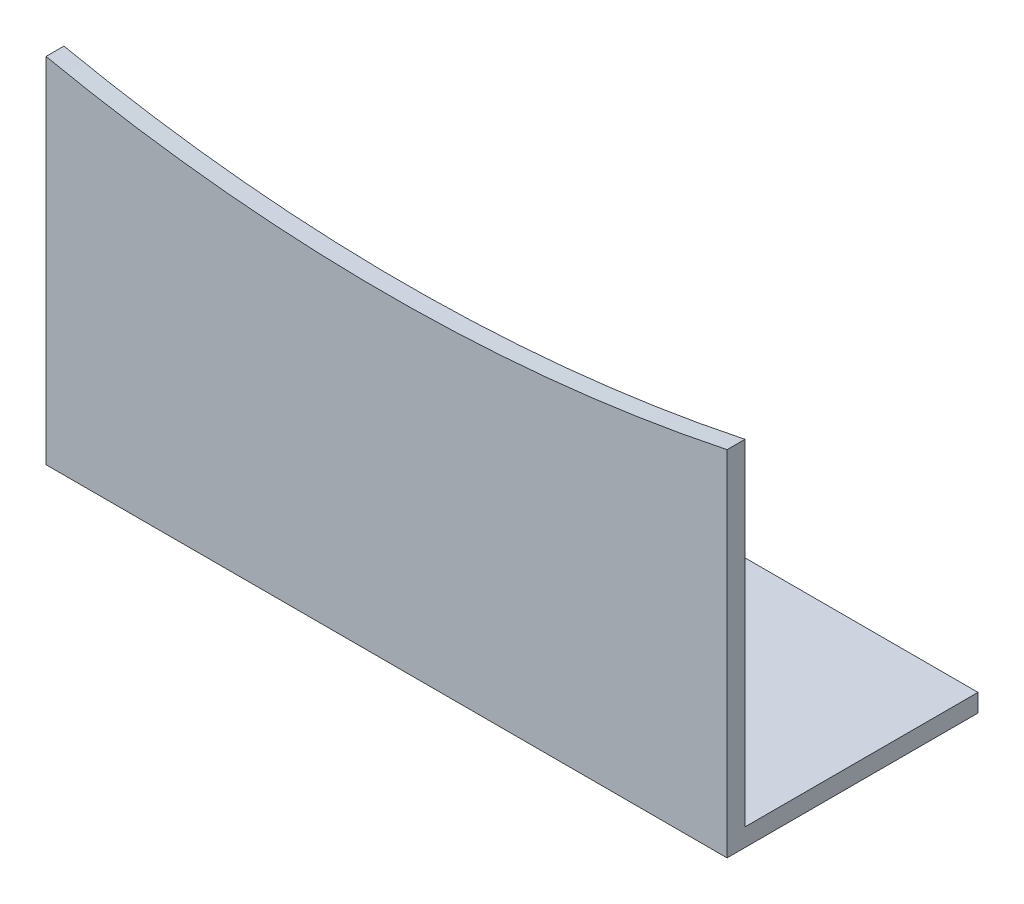
from build123d import *

# Parameters (mm, degrees)
BOSS_EXTRUDE1_DEPTH = 28
SHELL1_T            = -2


with BuildPart() as part:
    # Sketch1 → Boss-Extrude1 (new body)
    with BuildSketch(Plane.XY):
        with BuildLine():
            Line((38, -220), (38, -180.544315889))
            ThreePointArc((38, -180.544315889), (0, -184.5), (-38, -180.544315889))
            Line((-38, -180.544315889), (-38, -220))
            Line((-38, -220), (38, -220))
        make_face()
    extrude(amount=-BOSS_EXTRUDE1_DEPTH)

    # Shell1
    shell1_openings = [part.faces().sort_by_distance(p)[0] for p in [
        (38, -200.272157945, -14),
        (0, -184.5, -14),
        (0, -201.574740198, -28),
        (-38, -200.272157945, -14),
    ]]
    offset(amount=SHELL1_T, openings=shell1_openings, kind=Kind.INTERSECTION)


solid = part.part
